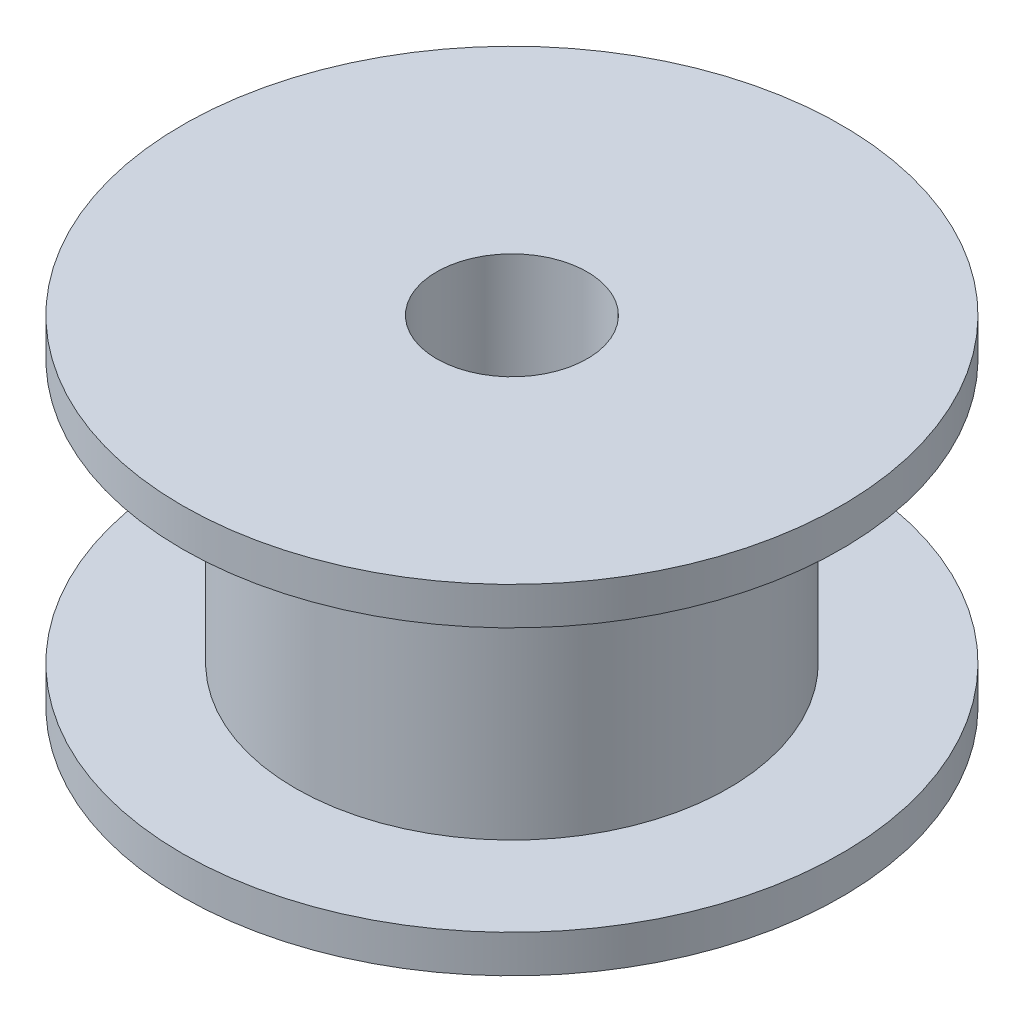
from build123d import *


with BuildPart() as part:
    # Sketch1 → Revolve1 (revolve)
    with BuildSketch(Plane.XY, mode=Mode.PRIVATE) as revolve1_sk:
        Polygon((2, 0), (8.75, 0), (8.75, -1), (5.75, -1), (5.75, -8), (8.75, -8), (8.75, -9), (2, -9), align=None)
    revolve(revolve1_sk.sketch.rotate(Axis((0, 0, 0), (0, -1, 0)), 90), axis=Axis((0, 0, 0), (0, -1, 0)))


solid = part.part
